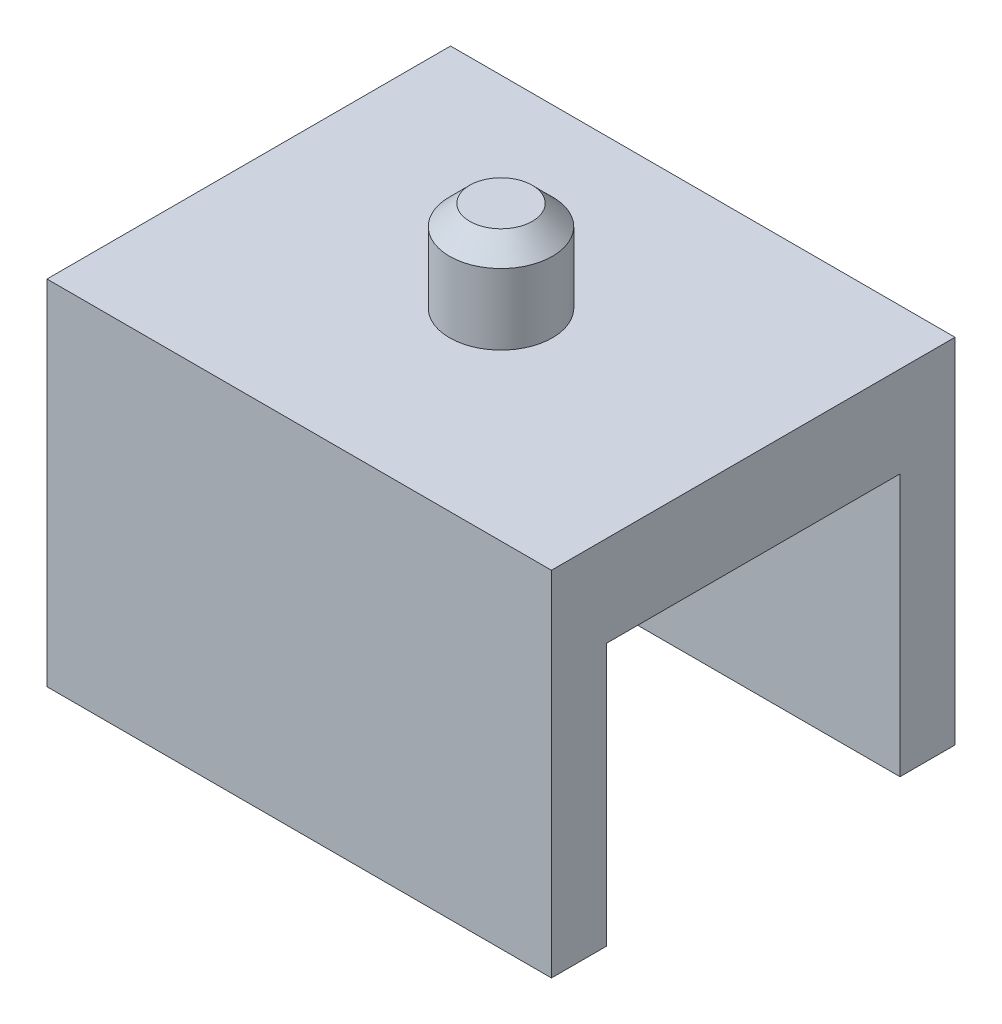
from build123d import *

# Parameters (mm, degrees)
SKETCH1_W           = 25
SKETCH1_H           = 17.5
BOSS_EXTRUDE1_DEPTH = 20
SKETCH2_W           = 25
SKETCH2_H           = 14.55
CUT_EXTRUDE1_DEPTH  = 13
SKETCH4_R           = 2.55
BOSS_EXTRUDE2_DEPTH = 4.5
CHAMFER1_SIZE       = 1
SKETCH5_R           = 1.25
BOSS_EXTRUDE3_DEPTH = 3
CHAMFER2_SIZE       = 1


with BuildPart() as part:
    # Sketch1 → Boss-Extrude1 (new body)
    with BuildSketch(Plane.XY):
        with Locations((12.5, 8.75)):
            Rectangle(SKETCH1_W, SKETCH1_H)
    extrude(amount=BOSS_EXTRUDE1_DEPTH)

    # Sketch2 → Cut-Extrude1 (cut)
    with BuildSketch(Plane.XZ):
        with Locations((12.5, 10)):
            Rectangle(SKETCH2_W, SKETCH2_H)
    extrude(amount=-CUT_EXTRUDE1_DEPTH, mode=Mode.SUBTRACT)

    # Sketch5 → Boss-Extrude3 (add)
    with BuildSketch(Plane(origin=(0, 13, 0), x_dir=(-1, 0, 0), z_dir=(0, -1, 0))):
        with Locations(Location((-12.5, -10, 0), (0, 0, 180))):
            Circle(SKETCH5_R)
    extrude(amount=BOSS_EXTRUDE3_DEPTH)

    # Chamfer2
    chamfer2_edges = [part.edges().sort_by_distance(p)[0] for p in [
        (11.25, 10, 10),
    ]]
    chamfer(chamfer2_edges, length=CHAMFER2_SIZE)


with BuildPart() as body_2:
    # Sketch4 → Boss-Extrude2 (new body)
    with BuildSketch(Plane(origin=(0, 17.5, 0), x_dir=(1, 0, 0), z_dir=(0, 1, 0))):
        with Locations(Location((12.5, -10, 0), (0, 0, 270))):
            Circle(SKETCH4_R)
    extrude(amount=BOSS_EXTRUDE2_DEPTH)

    # Chamfer1
    chamfer1_edges = [body_2.edges().sort_by_distance(p)[0] for p in [
        (12.5, 22, 7.45),
    ]]
    chamfer(chamfer1_edges, length=CHAMFER1_SIZE)


solid = Compound([part.part, body_2.part])
